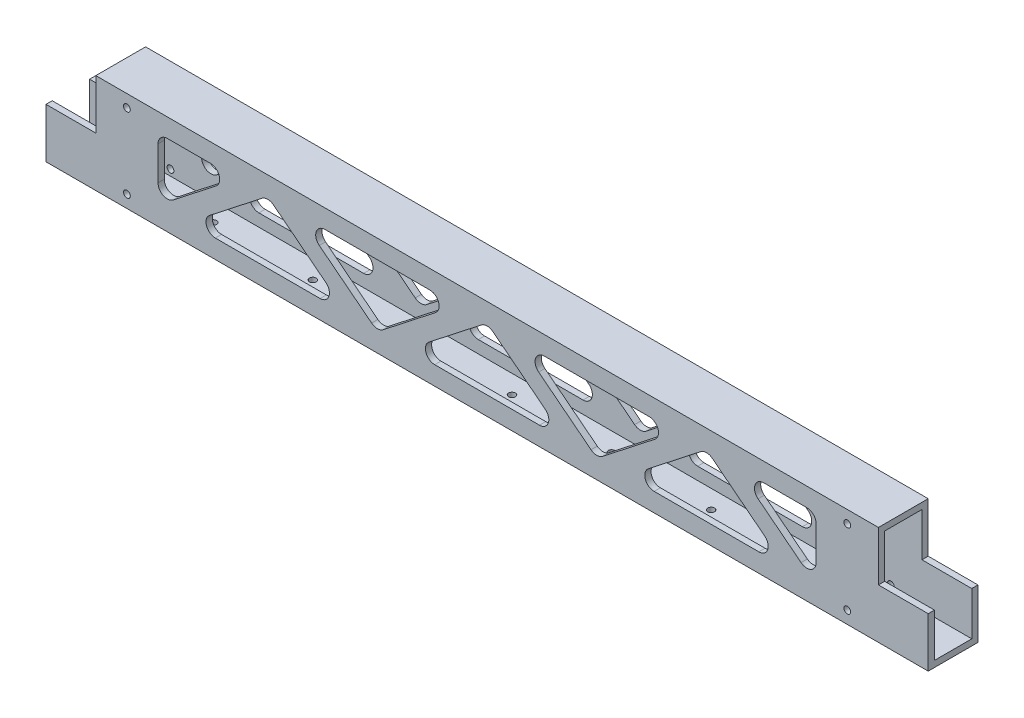
from build123d import *

# Parameters (mm, degrees)
SKETCH1_W                 = 25.4
SKETCH1_H                 = 50.8
SKETCH1_W_2               = 19.05
SKETCH1_H_2               = 44.45
BOSS_EXTRUDE1_DEPTH       = 225.02495
SKETCH2_W                 = 25.4
SKETCH2_H                 = 25.4
CUT_EXTRUDE1_DEPTH        = 228.873974211
F_8_32_TAPPED_HOLE1_D     = 3.4544
F_8_32_TAPPED_HOLE2_D     = 3.4544
F_8_32_TAPPED_HOLE2_DEPTH = 3.175
CUT_EXTRUDE2_DEPTH        = 228.873974211
FILLET1_R                 = 4.7625


with BuildPart() as part:
    # Sketch1 → Boss-Extrude1 (new, symmetric)
    with BuildSketch(Plane(origin=(0, 0, 0), x_dir=(0, 0, -1), z_dir=(1, 0, 0))):
        Rectangle(SKETCH1_W, SKETCH1_H)
        Rectangle(SKETCH1_W_2, SKETCH1_H_2, mode=Mode.SUBTRACT)
    extrude(amount=BOSS_EXTRUDE1_DEPTH, both=True)

    # Sketch2 → Cut-Extrude1 (cut, through all)
    with BuildSketch(Plane.XY.offset(12.7)):
        with Locations((-212.32495, 12.7)):
            Rectangle(SKETCH2_W, SKETCH2_H)
        with Locations((212.32495, 12.7)):
            Rectangle(SKETCH2_W, SKETCH2_H)
    extrude(amount=-CUT_EXTRUDE1_DEPTH, mode=Mode.SUBTRACT)

    # #8-32 Tapped Hole1 (through all)
    with Locations(Plane.XY.offset(12.7)):
        with Locations((-183.74995, 19.05), (-183.74995, -19.05), (183.74995, 19.05), (183.74995, -19.05)):
            Hole(F_8_32_TAPPED_HOLE1_D / 2)

    # #8-32 Tapped Hole2
    with Locations(Plane(origin=(0, -25.4, 0), x_dir=(-1, 0, 0), z_dir=(0, -1, 0))):
        with Locations((0, 0), (50.8, 0), (101.6, 0), (152.4, 0), (-50.8, 0), (-101.6, 0), (-152.4, 0)):
            Hole(F_8_32_TAPPED_HOLE2_D / 2, depth=F_8_32_TAPPED_HOLE2_DEPTH)

    # Sketch7 → Cut-Extrude2 (cut, through all)
    with BuildSketch(Plane.XY.offset(12.7)):
        Polygon((-167.87495, 15.875), (-167.87495, -15.875), (-127.358940675, 15.875), align=None)
        Polygon((-111.916633333, 15.875), (-152.432642658, -15.875), (-71.400624009, -15.875), align=None)
        Polygon((-96.474325991, 15.875), (-55.958316667, -15.875), (-15.442307342, 15.875), align=None)
        Polygon((0, 15.875), (-40.516009325, -15.875), (40.516009325, -15.875), align=None)
        Polygon((15.442307342, 15.875), (55.958316667, -15.875), (96.474325991, 15.875), align=None)
        Polygon((111.916633333, 15.875), (71.400624009, -15.875), (152.432642658, -15.875), align=None)
        Polygon((167.87495, 15.875), (167.87495, -15.875), (127.358940675, 15.875), align=None)
    extrude(amount=-CUT_EXTRUDE2_DEPTH, mode=Mode.SUBTRACT)

    # Fillet1
    fillet1_edges = [part.edges().sort_by_distance(p)[0] for p in [
        (-167.87495, 15.875, -11.1125),
        (-127.358940675, 15.875, -11.1125),
        (-167.87495, -15.875, -11.1125),
        (-167.87495, 15.875, 11.1125),
        (-127.358940675, 15.875, 11.1125),
        (-167.87495, -15.875, 11.1125),
        (-111.916633333, 15.875, -11.1125),
        (-71.400624009, -15.875, -11.1125),
        (-152.432642658, -15.875, -11.1125),
        (-111.916633333, 15.875, 11.1125),
        (-71.400624009, -15.875, 11.1125),
        (-152.432642658, -15.875, 11.1125),
        (0, 15.875, -11.1125),
        (40.516009325, -15.875, -11.1125),
        (-40.516009325, -15.875, -11.1125),
        (0, 15.875, 11.1125),
        (40.516009325, -15.875, 11.1125),
        (-40.516009325, -15.875, 11.1125),
        (-96.474325991, 15.875, -11.1125),
        (-15.442307342, 15.875, -11.1125),
        (-55.958316667, -15.875, -11.1125),
        (-96.474325991, 15.875, 11.1125),
        (-15.442307342, 15.875, 11.1125),
        (-55.958316667, -15.875, 11.1125),
        (15.442307342, 15.875, -11.1125),
        (96.474325991, 15.875, -11.1125),
        (55.958316667, -15.875, -11.1125),
        (15.442307342, 15.875, 11.1125),
        (96.474325991, 15.875, 11.1125),
        (55.958316667, -15.875, 11.1125),
        (111.916633333, 15.875, -11.1125),
        (152.432642658, -15.875, -11.1125),
        (71.400624009, -15.875, -11.1125),
        (111.916633333, 15.875, 11.1125),
        (152.432642658, -15.875, 11.1125),
        (71.400624009, -15.875, 11.1125),
        (127.358940675, 15.875, -11.1125),
        (167.87495, 15.875, -11.1125),
        (167.87495, -15.875, -11.1125),
        (127.358940675, 15.875, 11.1125),
        (167.87495, 15.875, 11.1125),
        (167.87495, -15.875, 11.1125),
    ]]
    fillet(fillet1_edges, radius=FILLET1_R)


solid = part.part
